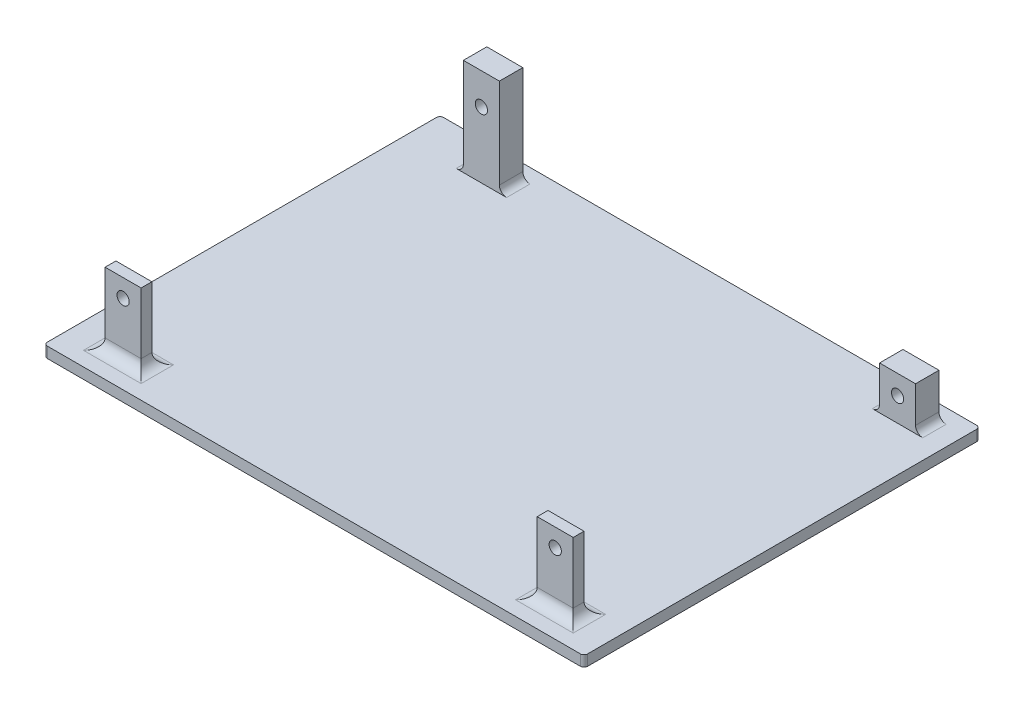
from build123d import *

# Parameters (mm, degrees)
SKETCH1_W            = 150
SKETCH1_H            = 110
BOSS_EXTRUDE1_DEPTH  = 1.5
SKETCH2_W            = 10
SKETCH2_H            = 6.5
BOSS_EXTRUDE2_DEPTH  = 12
SKETCH3_W            = 10
SKETCH3_H            = 6.5
BOSS_EXTRUDE3_DEPTH  = 15
M3_CLEARANCE_HOLE1_D = 3.4
FILLET1_R            = 2
M3_CLEARANCE_HOLE2_D = 3.4
SKETCH8_W            = 10
SKETCH8_H            = 3
BOSS_EXTRUDE4_DEPTH  = 20
FILLET2_R            = 3
M3_CLEARANCE_HOLE3_D = 3.4
FILLET2_OF_MIRROR1_R = 3
FILLET3_R            = 1


with BuildPart() as part:
    # Sketch1 → Boss-Extrude1 (new, symmetric)
    with BuildSketch(Plane(origin=(0, 0, 0), x_dir=(1, 0, 0), z_dir=(0, 1, 0))):
        Rectangle(SKETCH1_W, SKETCH1_H)
    extrude(amount=BOSS_EXTRUDE1_DEPTH, both=True)

    # Sketch2 → Boss-Extrude2 (add)
    with BuildSketch(Plane(origin=(0, 1.5, 0), x_dir=(1, 0, 0), z_dir=(0, 1, 0))):
        with Locations((62.57, 47.75)):
            Rectangle(SKETCH2_W, SKETCH2_H)
        with Locations((-53, 47.75)):
            Rectangle(SKETCH2_W, SKETCH2_H)
    extrude(amount=BOSS_EXTRUDE2_DEPTH)

    # Sketch3 → Boss-Extrude3 (add)
    with BuildSketch(Plane(origin=(0, 13.5, 0), x_dir=(1, 0, 0), z_dir=(0, 1, 0))):
        with Locations((-53, 47.75)):
            Rectangle(SKETCH3_W, SKETCH3_H)
    extrude(amount=BOSS_EXTRUDE3_DEPTH)

    # M3 Clearance Hole1 (through all)
    with Locations(Plane.XY.offset(-44.5)):
        with Locations((-53, 19.77)):
            Hole(M3_CLEARANCE_HOLE1_D / 2)

    # Fillet1
    fillet1_edges = [part.edges().sort_by_distance(p)[0] for p in [
        (67.57, 1.5, -47.75),
        (57.57, 1.5, -47.75),
        (-48, 1.5, -47.75),
        (-58, 1.5, -47.75),
    ]]
    fillet(fillet1_edges, radius=FILLET1_R)

    # M3 Clearance Hole2 (through all)
    with Locations(Plane.XY.offset(-44.5)):
        with Locations((62.57, 8.09)):
            Hole(M3_CLEARANCE_HOLE2_D / 2)

    # Sketch8 → Boss-Extrude4 (add)
    with BuildSketch(Plane(origin=(0, 1.5, 0), x_dir=(1, 0, 0), z_dir=(0, 1, 0))):
        with Locations((-60, -46.5)):
            Rectangle(SKETCH8_W, SKETCH8_H)
    boss_extrude4 = extrude(amount=BOSS_EXTRUDE4_DEPTH)

    # Fillet2
    fillet2_edges = [part.edges().sort_by_distance(p)[0] for p in [
        (-55, 1.5, 46.5),
        (-60, 1.5, 45),
        (-65, 1.5, 46.5),
        (-60, 1.5, 48),
    ]]
    fillet(fillet2_edges, radius=FILLET2_R)

    # M3 Clearance Hole3 (through all)
    with Locations(Plane.XY.offset(48)):
        with Locations((-60, 16.5)):
            m3_clearance_hole3 = Hole(M3_CLEARANCE_HOLE3_D / 2)

    # Mirror1: Boss-Extrude4, M3 Clearance Hole3 across plane
    add(boss_extrude4.mirror(Plane(origin=(0, 0, 0), x_dir=(0, 0, 1), z_dir=(1, 0, 0))))
    add(m3_clearance_hole3.mirror(Plane(origin=(0, 0, 0), x_dir=(0, 0, 1), z_dir=(1, 0, 0))), mode=Mode.SUBTRACT)

    # Fillet2 of Mirror1
    fillet2_of_mirror1_edges = [part.edges().sort_by_distance(p)[0] for p in [
        (55, 1.5, 46.5),
        (60, 1.5, 45),
        (65, 1.5, 46.5),
        (60, 1.5, 48),
    ]]
    fillet(fillet2_of_mirror1_edges, radius=FILLET2_OF_MIRROR1_R)

    # Fillet3
    fillet3_edges = [part.edges().sort_by_distance(p)[0] for p in [
        (-75, 0, -55),
        (75, 0, -55),
        (75, 0, 55),
        (-75, 0, 55),
    ]]
    fillet(fillet3_edges, radius=FILLET3_R)


solid = part.part
